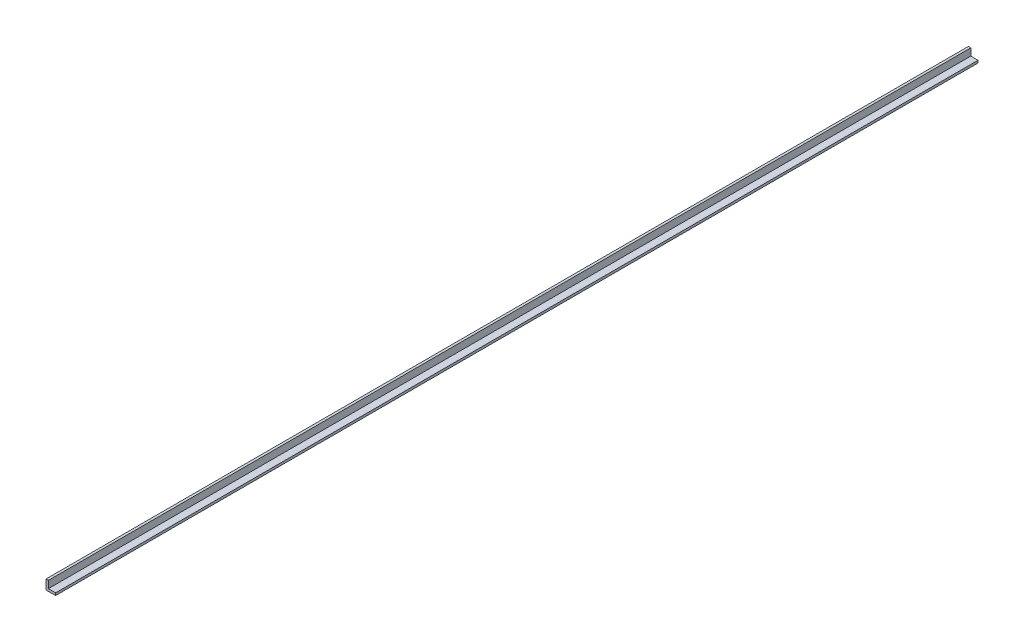
from build123d import *

# Parameters (mm, degrees)
BOSS_EXTRUDE1_DEPTH = 609.6


with BuildPart() as part:
    # Sketch1 → Boss-Extrude1 (new, symmetric)
    with BuildSketch(Plane.XY):
        Polygon((0, 0), (0, 12.7), (3.175, 12.7), (3.175, 3.175), (12.7, 3.175), (12.7, 0), align=None)
    extrude(amount=BOSS_EXTRUDE1_DEPTH, both=True)


solid = part.part
